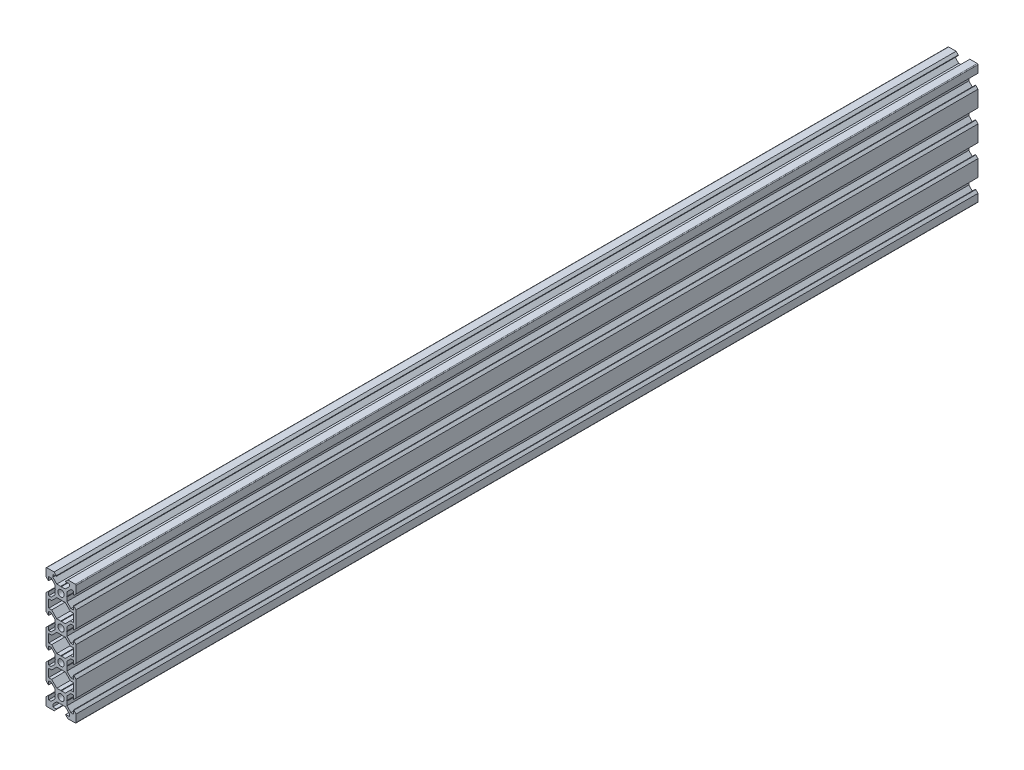
from build123d import *

# Parameters (mm, degrees)
BOSS_EXTRU_1_DEPTH = 600


with BuildPart() as part:
    # Esquisse1 → Boss.-Extru.1 (new body)
    with BuildSketch(Plane.XY):
        with BuildLine():
            Line((-9.5, 10), (-4.58, 10))
            Line((-4.58, 10), (-3.125, 8.545))
            Line((-3.125, 8.545), (-3.125, 8.2))
            Line((-3.125, 8.2), (-5.5, 8.2))
            Line((-5.5, 8.2), (-5.5, 6.560660172))
            Line((-5.5, 6.560660172), (-2.839339828, 3.9))
            Line((-2.839339828, 3.9), (-0.21, 3.9))
            Line((-0.21, 3.9), (0, 3.69))
            Line((0, 3.69), (0, 2.1))
            ThreePointArc((0, 2.1), (-2.1, 0), (0, -2.1))
            Line((0, -2.1), (0, -3.69))
            Line((0, -3.69), (-0.21, -3.9))
            Line((-0.21, -3.9), (-2.839339828, -3.9))
            Line((-2.839339828, -3.9), (-6.239339828, -7.3))
            Line((-6.239339828, -7.3), (-8.2, -7.3))
            Line((-8.2, -7.3), (-8.2, -12.7))
            Line((-8.2, -12.7), (-6.239339828, -12.7))
            Line((-6.239339828, -12.7), (-2.839339828, -16.1))
            Line((-2.839339828, -16.1), (-0.21, -16.1))
            Line((-0.21, -16.1), (0, -16.31))
            Line((0, -16.31), (0, -17.9))
            ThreePointArc((0, -17.9), (-2.1, -20), (0, -22.1))
            Line((0, -22.1), (0, -23.69))
            Line((0, -23.69), (-0.21, -23.9))
            Line((-0.21, -23.9), (-2.839339828, -23.9))
            Line((-2.839339828, -23.9), (-6.239339828, -27.3))
            Line((-6.239339828, -27.3), (-8.2, -27.3))
            Line((-8.2, -27.3), (-8.2, -32.7))
            Line((-8.2, -32.7), (-6.239339828, -32.7))
            Line((-6.239339828, -32.7), (-2.839339828, -36.1))
            Line((-2.839339828, -36.1), (-0.21, -36.1))
            Line((-0.21, -36.1), (0, -36.31))
            Line((0, -36.31), (0, -37.9))
            ThreePointArc((0, -37.9), (-2.1, -40), (0, -42.1))
            Line((0, -42.1), (0, -43.69))
            Line((0, -43.69), (-0.21, -43.9))
            Line((-0.21, -43.9), (-2.839339828, -43.9))
            Line((-2.839339828, -43.9), (-6.239339828, -47.3))
            Line((-6.239339828, -47.3), (-8.2, -47.3))
            Line((-8.2, -47.3), (-8.2, -52.7))
            Line((-8.2, -52.7), (-6.239339828, -52.7))
            Line((-6.239339828, -52.7), (-2.839339828, -56.1))
            Line((-2.839339828, -56.1), (-0.21, -56.1))
            Line((-0.21, -56.1), (0, -56.31))
            Line((0, -56.31), (0, -57.9))
            ThreePointArc((0, -57.9), (-2.1, -60), (0, -62.1))
            Line((0, -62.1), (0, -63.69))
            Line((0, -63.69), (-0.21, -63.9))
            Line((-0.21, -63.9), (-2.839339828, -63.9))
            Line((-2.839339828, -63.9), (-5.5, -66.560660172))
            Line((-5.5, -66.560660172), (-5.5, -68.2))
            Line((-5.5, -68.2), (-3.125, -68.2))
            Line((-3.125, -68.2), (-3.125, -68.545))
            Line((-3.125, -68.545), (-4.58, -70))
            Line((-4.58, -70), (-9.5, -70))
            ThreePointArc((-9.5, -70), (-9.853553391, -69.853553391), (-10, -69.5))
            Line((-10, -69.5), (-10, -64.58))
            Line((-10, -64.58), (-8.545, -63.125))
            Line((-8.545, -63.125), (-8.2, -63.125))
            Line((-8.2, -63.125), (-8.2, -65.5))
            Line((-8.2, -65.5), (-6.560660172, -65.5))
            Line((-6.560660172, -65.5), (-3.9, -62.839339828))
            Line((-3.9, -62.839339828), (-3.9, -60.21))
            Line((-3.9, -60.21), (-3.69, -60))
            Line((-3.69, -60), (-3.9, -59.79))
            Line((-3.9, -59.79), (-3.9, -57.160660172))
            Line((-3.9, -57.160660172), (-6.560660172, -54.5))
            Line((-6.560660172, -54.5), (-8.2, -54.5))
            Line((-8.2, -54.5), (-8.2, -56.875))
            Line((-8.2, -56.875), (-8.545, -56.875))
            Line((-8.545, -56.875), (-10, -55.42))
            Line((-10, -55.42), (-10, -44.58))
            Line((-10, -44.58), (-8.545, -43.125))
            Line((-8.545, -43.125), (-8.2, -43.125))
            Line((-8.2, -43.125), (-8.2, -45.5))
            Line((-8.2, -45.5), (-6.560660172, -45.5))
            Line((-6.560660172, -45.5), (-3.9, -42.839339828))
            Line((-3.9, -42.839339828), (-3.9, -40.21))
            Line((-3.9, -40.21), (-3.69, -40))
            Line((-3.69, -40), (-3.9, -39.79))
            Line((-3.9, -39.79), (-3.9, -37.160660172))
            Line((-3.9, -37.160660172), (-6.560660172, -34.5))
            Line((-6.560660172, -34.5), (-8.2, -34.5))
            Line((-8.2, -34.5), (-8.2, -36.875))
            Line((-8.2, -36.875), (-8.545, -36.875))
            Line((-8.545, -36.875), (-10, -35.42))
            Line((-10, -35.42), (-10, -24.58))
            Line((-10, -24.58), (-8.545, -23.125))
            Line((-8.545, -23.125), (-8.2, -23.125))
            Line((-8.2, -23.125), (-8.2, -25.5))
            Line((-8.2, -25.5), (-6.560660172, -25.5))
            Line((-6.560660172, -25.5), (-3.9, -22.839339828))
            Line((-3.9, -22.839339828), (-3.9, -20.21))
            Line((-3.9, -20.21), (-3.69, -20))
            Line((-3.69, -20), (-3.9, -19.79))
            Line((-3.9, -19.79), (-3.9, -17.160660172))
            Line((-3.9, -17.160660172), (-6.560660172, -14.5))
            Line((-6.560660172, -14.5), (-8.2, -14.5))
            Line((-8.2, -14.5), (-8.2, -16.875))
            Line((-8.2, -16.875), (-8.545, -16.875))
            Line((-8.545, -16.875), (-10, -15.42))
            Line((-10, -15.42), (-10, -4.58))
            Line((-10, -4.58), (-8.545, -3.125))
            Line((-8.545, -3.125), (-8.2, -3.125))
            Line((-8.2, -3.125), (-8.2, -5.5))
            Line((-8.2, -5.5), (-6.560660172, -5.5))
            Line((-6.560660172, -5.5), (-3.9, -2.839339828))
            Line((-3.9, -2.839339828), (-3.9, -0.21))
            Line((-3.9, -0.21), (-3.69, 0))
            Line((-3.69, 0), (-3.9, 0.21))
            Line((-3.9, 0.21), (-3.9, 2.839339828))
            Line((-3.9, 2.839339828), (-6.560660172, 5.5))
            Line((-6.560660172, 5.5), (-8.2, 5.5))
            Line((-8.2, 5.5), (-8.2, 3.125))
            Line((-8.2, 3.125), (-8.545, 3.125))
            Line((-8.545, 3.125), (-10, 4.58))
            Line((-10, 4.58), (-10, 9.5))
            ThreePointArc((-10, 9.5), (-9.853553391, 9.853553391), (-9.5, 10))
        make_face()
    boss_extru_1 = extrude(amount=BOSS_EXTRU_1_DEPTH)

    # Symétrie1: Boss.-Extru.1 across Right Plane
    add(boss_extru_1.mirror(Plane(origin=(0, 0, 0), x_dir=(0, 0, -1), z_dir=(1, 0, 0))))


solid = part.part
